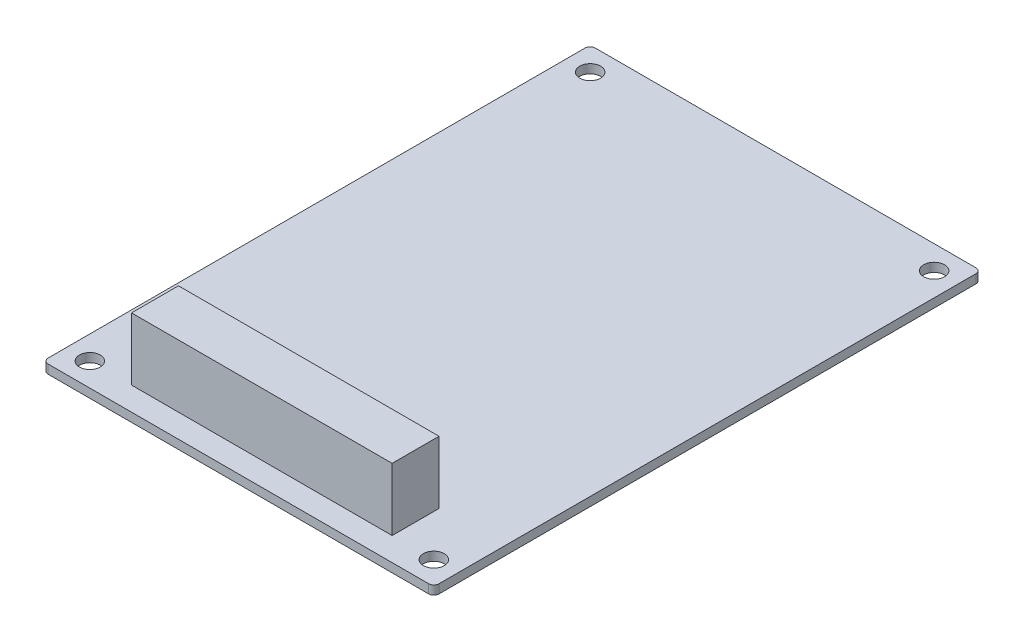
from build123d import *

# Parameters (mm, degrees)
ESQUISSE1_W                   = 75
ESQUISSE1_H                   = 105
BOSS_EXTRU_1_DEPTH            = 1.7
DIAM_TRE_DU_PER_AGE_4_0_4_1_D = 4
CONG_1_R                      = 1
BOSS_EXTRU_2_DEPTH            = 12
BOSS_EXTRU_2_DEPTH_BACK       = 5
ESQUISSE4_W                   = 50
ESQUISSE4_H                   = 9


with BuildPart() as part:
    # Esquisse1 → Boss.-Extru.1 (new body)
    with BuildSketch(Plane(origin=(0, 0, 0), x_dir=(1, 0, 0), z_dir=(0, 1, 0))):
        with Locations((37.5, -52.5)):
            Rectangle(ESQUISSE1_W, ESQUISSE1_H)
    extrude(amount=BOSS_EXTRU_1_DEPTH)

    # Diamètre du perçage Ø4.0 (4)1 (through all)
    with Locations(Plane(origin=(0, 1.7, 0), x_dir=(1, 0, 0), z_dir=(0, 1, 0))):
        with Locations((70.5, -100.5), (4.5, -100.5), (70.5, -4.5), (4.5, -4.5)):
            Hole(DIAM_TRE_DU_PER_AGE_4_0_4_1_D / 2)

    # Congé1
    cong_1_edges = [part.edges().sort_by_distance(p)[0] for p in [
        (0, 0.85, 0),
        (75, 0.85, 0),
        (75, 0.85, 105),
        (0, 0.85, 105),
    ]]
    fillet(cong_1_edges, radius=CONG_1_R)

    # Esquisse4 → Boss.-Extru.2 (add, two sides: drawn at the far end of the back side and taken through both)
    with BuildSketch(Plane(origin=(0, 1.7, 0), x_dir=(1, 0, 0), z_dir=(0, 1, 0)).offset(-BOSS_EXTRU_2_DEPTH_BACK)):
        with Locations((37.5, -96)):
            Rectangle(ESQUISSE4_W, ESQUISSE4_H)
    extrude(amount=BOSS_EXTRU_2_DEPTH + BOSS_EXTRU_2_DEPTH_BACK)


solid = part.part
